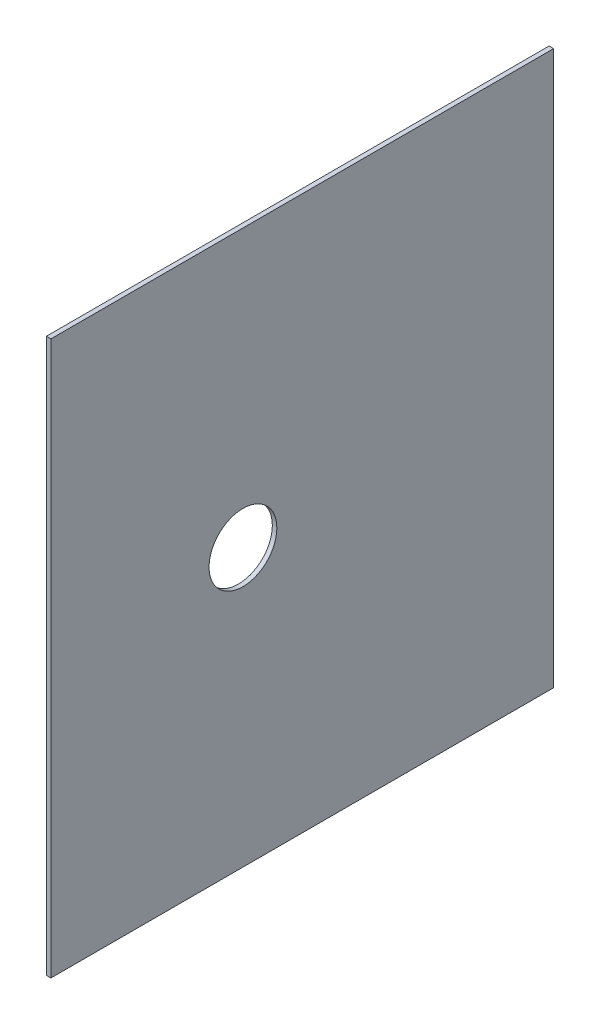
from build123d import *

# Parameters (mm, degrees)
SKETCH1_W           = 445
SKETCH1_H           = 490
SKETCH1_R           = 30
BOSS_EXTRUDE1_DEPTH = 4


with BuildPart() as part:
    # Sketch1 → Boss-Extrude1 (new body)
    with BuildSketch(Plane(origin=(0, 0, 0), x_dir=(0, 0, -1), z_dir=(1, 0, 0))):
        with Locations((222.5, 245)):
            Rectangle(SKETCH1_W, SKETCH1_H)
        with Locations((170, 245)):
            Circle(SKETCH1_R, mode=Mode.SUBTRACT)
    extrude(amount=BOSS_EXTRUDE1_DEPTH)


solid = part.part
